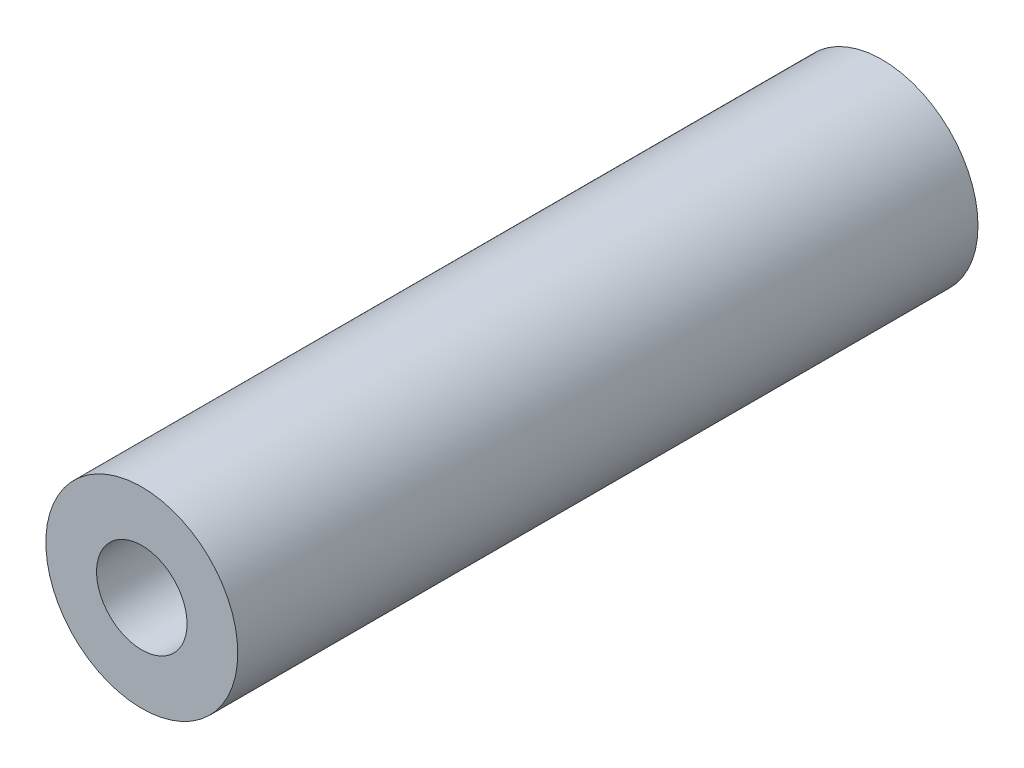
from build123d import *

# Parameters (mm, degrees)
SKETCH_1_R      = 3.5
SKETCH_1_R_2    = 1.65
EXTRUDE_1_DEPTH = 27


with BuildPart() as part:
    # 草图1 → 凸台-拉伸1 (new body)
    with BuildSketch(Plane.XY):
        Circle(SKETCH_1_R)
        Circle(SKETCH_1_R_2, mode=Mode.SUBTRACT)
    extrude(amount=EXTRUDE_1_DEPTH)


solid = part.part
